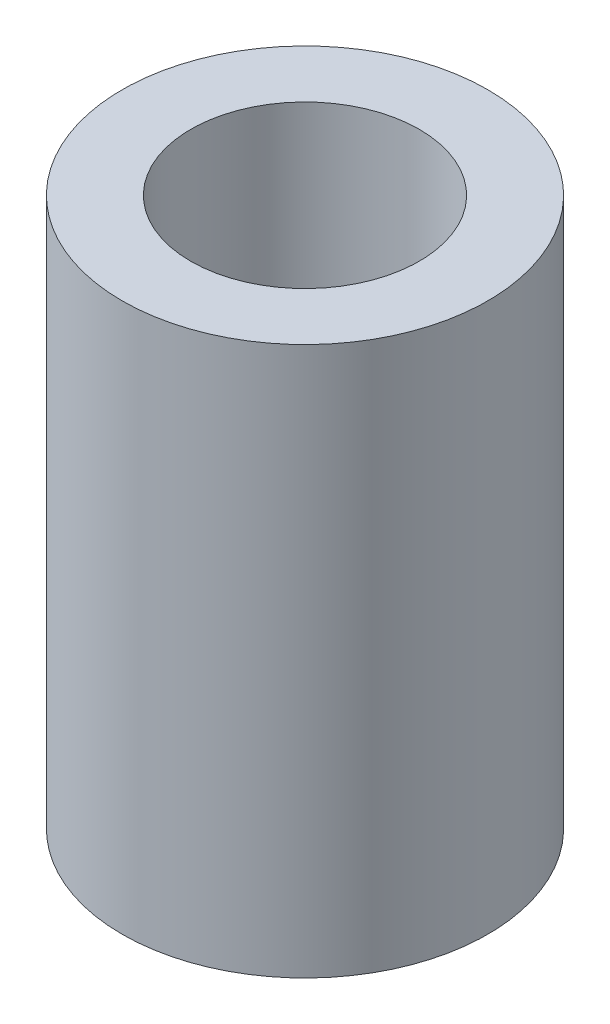
from build123d import *

# Parameters (mm, degrees)
SKETCH_1_R      = 8
SKETCH_1_R_2    = 5
EXTRUDE_1_DEPTH = 24


with BuildPart() as part:
    # 草图1 → 凸台-拉伸1 (new body)
    with BuildSketch(Plane(origin=(0, 0, 0), x_dir=(1, 0, 0), z_dir=(0, 1, 0))):
        with Locations(Location((0, 0, 0), (0, 0, 270))):
            Circle(SKETCH_1_R)
        with Locations(Location((0, 0, 0), (0, 0, 270))):
            Circle(SKETCH_1_R_2, mode=Mode.SUBTRACT)
    extrude(amount=EXTRUDE_1_DEPTH)


solid = part.part
